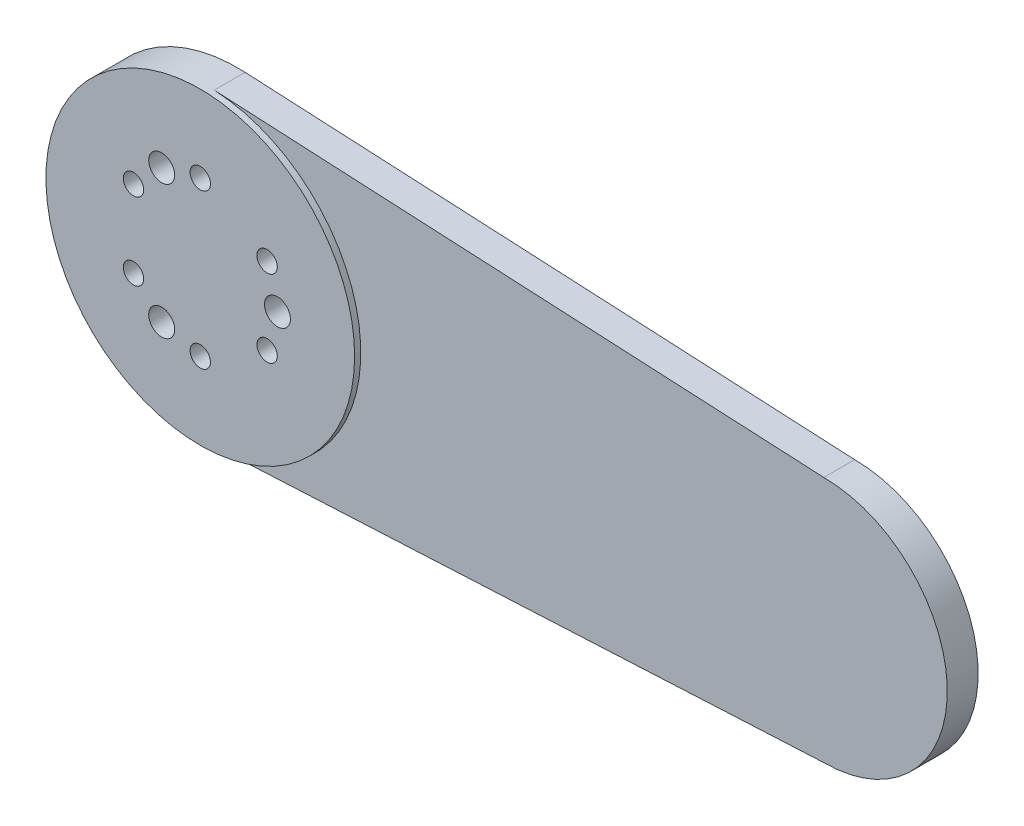
from build123d import *
from build123d.topology import SkipClean

# Parameters (mm, degrees)
SKETCH_1_R          = 1.65
SKETCH_1_R_2        = 2.1
EXTRUDE_1_DEPTH     = 3
CUT_EXTRUDE_START   = -1
CUT_EXTRUDE_1_DEPTH = 1
EXTRUDE_START       = 3
EXTRUDE_2_DEPTH     = 3


with BuildPart() as part:
    # 草图1 → 凸台-拉伸1 (new body)
    with BuildSketch(Plane.XY):
        with BuildLine():
            Line((100, 20), (1.256317324, 24.968413381))
            ThreePointArc((1.256317324, 24.968413381), (-25, 0), (1.256317324, -24.968413381))
            Line((1.256317324, -24.968413381), (100, -20))
            ThreePointArc((100, -20), (120, 0), (100, 20))
        make_face()
        with Locations((0, 12.5)):
            Circle(SKETCH_1_R, mode=Mode.SUBTRACT)
        with Locations((10.825317547, 6.25)):
            Circle(SKETCH_1_R, mode=Mode.SUBTRACT)
        with Locations((10.825317547, -6.25)):
            Circle(SKETCH_1_R, mode=Mode.SUBTRACT)
        with Locations((0, -12.5)):
            Circle(SKETCH_1_R, mode=Mode.SUBTRACT)
        with Locations((-10.825317547, -6.25)):
            Circle(SKETCH_1_R, mode=Mode.SUBTRACT)
        with Locations((-10.825317547, 6.25)):
            Circle(SKETCH_1_R, mode=Mode.SUBTRACT)
        with Locations((12.5, 0)):
            Circle(SKETCH_1_R_2, mode=Mode.SUBTRACT)
        with Locations((-6.25, -10.825317547)):
            Circle(SKETCH_1_R_2, mode=Mode.SUBTRACT)
        with Locations((-6.25, 10.825317547)):
            Circle(SKETCH_1_R_2, mode=Mode.SUBTRACT)
    extrude(amount=EXTRUDE_1_DEPTH)

    # 草图2 → 切除-拉伸1 (cut)
    with BuildSketch(Plane.XY.offset(3).offset(CUT_EXTRUDE_START)):
        with BuildLine():
            Line((0, -25), (16.441406611, -41.341506065))
            Line((16.441406611, -41.341506065), (118.326184248, -37.878892612))
            Line((118.326184248, -37.878892612), (135.744179189, 2.203481288))
            Line((135.744179189, 2.203481288), (127.035181718, 31.058593389))
            Line((127.035181718, 31.058593389), (19.589237022, 36.095122046))
            Line((19.589237022, 36.095122046), (0, 25))
            ThreePointArc((0, 25), (25, 0), (0, -25))
        make_face()
    extrude(amount=CUT_EXTRUDE_1_DEPTH, mode=Mode.SUBTRACT)

    # 草图3 → 凸台-拉伸2 (add)
    with SkipClean():  # the faces are left unmerged after this step: merging them gives an invalid solid
        with BuildSketch(Plane(origin=(0, 0, 0), x_dir=(-1, 0, 0), z_dir=(0, 0, -1)).offset(EXTRUDE_START)):
            with BuildLine():
                Line((-100, -20), (-1.256317324, -24.968413381))
                ThreePointArc((-1.256317324, -24.968413381), (25, 0), (-1.256317324, 24.968413381))
                Line((-1.256317324, 24.968413381), (-100, 20))
                ThreePointArc((-100, 20), (-120, 0), (-100, -20))
            make_face()
            with BuildLine():
                Line((-1.105559245, 21.972203776), (-99.92763442, 16.999845976))
                ThreePointArc((-99.92763442, 16.999845976), (-117, 0), (-99.92763442, -16.999845976))
                Line((-99.92763442, -16.999845976), (-1.105559245, -21.972203776))
                ThreePointArc((-1.105559245, -21.972203776), (22, 0), (-1.105559245, 21.972203776))
            make_face(mode=Mode.SUBTRACT)
        extrude(amount=-EXTRUDE_2_DEPTH)


solid = part.part
